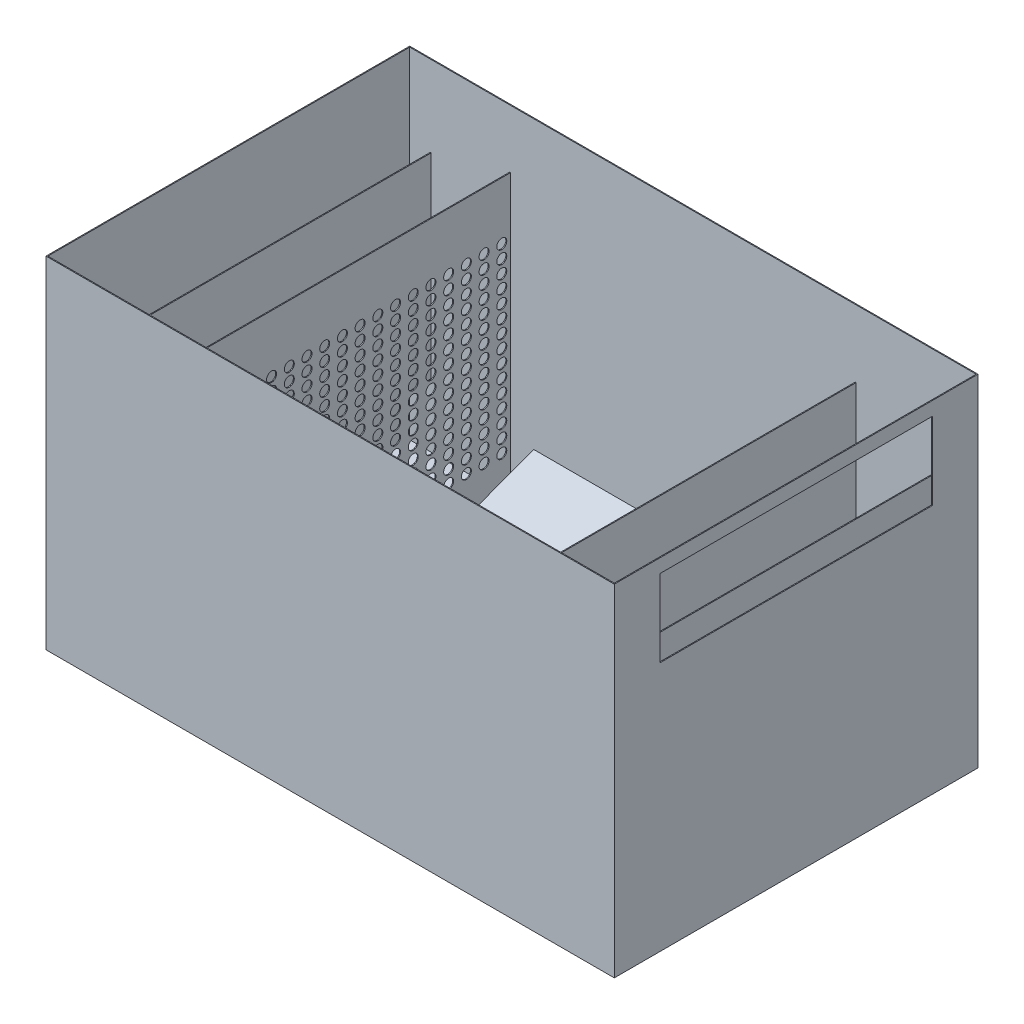
from build123d import *

# Parameters (mm, degrees)
MASTER_FOOTPRINT_W            = 1250
MASTER_FOOTPRINT_H            = 800
BATH_BASE_PLATE_DEPTH         = 750
BATH_SHELL_2MM_T              = -2
SKETCH_1_R                    = 50
INLET_D100_OPENING_DEPTH      = 10
INLET_IMPACT_BAFFLE_START     = 125
SKETCH_2_W                    = 640
SKETCH_2_H                    = 430
INLET_IMPACT_BAFFLE_DEPTH     = 2
DISTRIBUTOR_D22_START         = 250
SKETCH_3_W                    = 740
SKETCH_3_H                    = 648
SKETCH_3_R                    = 11
DISTRIBUTOR_D22_DEPTH         = 2
OUTLET_SUBMERGED_BAFFLE_START = 1030
SKETCH_4_W                    = 700
SKETCH_4_H                    = 330
OUTLET_SUBMERGED_BAFFLE_DEPTH = 2
OVERFLOW_WEIR_Z550_START      = 1190
SKETCH_5_W                    = 790
SKETCH_5_H                    = 548
OVERFLOW_WEIR_Z550_DEPTH      = 2
OUTLET_WEIR_SLOT_W600_START   = 1245
SKETCH_6_W                    = 600
SKETCH_6_H                    = 170
OUTLET_WEIR_SLOT_W600_DEPTH   = 10
SLOPED_SEDIMENT_FLOOR_START   = 275
SLOPED_SEDIMENT_FLOOR_DEPTH   = 725


with BuildPart() as part:
    # MASTER_FOOTPRINT → BATH_BASE_PLATE (new body)
    with BuildSketch(Plane(origin=(0, 0, 0), x_dir=(1, 0, 0), z_dir=(0, 1, 0))):
        with Locations((625, 400)):
            Rectangle(MASTER_FOOTPRINT_W, MASTER_FOOTPRINT_H)
    extrude(amount=BATH_BASE_PLATE_DEPTH)

    # BATH_SHELL_2MM
    bath_shell_2mm_openings = [part.faces().sort_by_distance(p)[0] for p in [
        (625, 750, -400),
    ]]
    offset(amount=BATH_SHELL_2MM_T, openings=bath_shell_2mm_openings, kind=Kind.INTERSECTION)

    # Эскиз1 → INLET_D100_OPENING (cut)
    with BuildSketch(Plane(origin=(0, 0, 0), x_dir=(0, 0, -1), z_dir=(1, 0, 0))):
        with Locations((400, 420)):
            Circle(SKETCH_1_R)
    extrude(amount=INLET_D100_OPENING_DEPTH, mode=Mode.SUBTRACT)

    # Эскиз6 → OUTLET_WEIR_SLOT_W600 (cut)
    with BuildSketch(Plane(origin=(0, 0, 0), x_dir=(0, 0, -1), z_dir=(1, 0, 0)).offset(OUTLET_WEIR_SLOT_W600_START)):
        with Locations((400, 635)):
            Rectangle(SKETCH_6_W, SKETCH_6_H)
    extrude(amount=OUTLET_WEIR_SLOT_W600_DEPTH, mode=Mode.SUBTRACT)

    # Эскиз7 → SLOPED_SEDIMENT_FLOOR (add)
    with BuildSketch(Plane(origin=(0, 0, 0), x_dir=(0, 0, -1), z_dir=(1, 0, 0)).offset(SLOPED_SEDIMENT_FLOOR_START)):
        Polygon((2, -1), (2, 120), (330, -1), align=None)
        Polygon((798, -1), (798, 120), (470, -1), align=None)
    extrude(amount=SLOPED_SEDIMENT_FLOOR_DEPTH)


with BuildPart() as body_2:
    # Эскиз2 → INLET_IMPACT_BAFFLE (new body)
    with BuildSketch(Plane(origin=(0, 0, 0), x_dir=(0, 0, -1), z_dir=(1, 0, 0)).offset(INLET_IMPACT_BAFFLE_START)):
        with Locations((400, 435)):
            Rectangle(SKETCH_2_W, SKETCH_2_H)
    extrude(amount=INLET_IMPACT_BAFFLE_DEPTH)


with BuildPart() as body_3:
    # Эскиз3 → DISTRIBUTOR_D22 (new body)
    with BuildSketch(Plane(origin=(0, 0, 0), x_dir=(0, 0, -1), z_dir=(1, 0, 0)).offset(DISTRIBUTOR_D22_START)):
        with Locations((400, 326)):
            Rectangle(SKETCH_3_W, SKETCH_3_H)
        with Locations((49.473684211, 125)):
            Circle(SKETCH_3_R, mode=Mode.SUBTRACT)
        with Locations((49.473684211, 153.5)):
            Circle(SKETCH_3_R, mode=Mode.SUBTRACT)
        with Locations((49.473684211, 182)):
            Circle(SKETCH_3_R, mode=Mode.SUBTRACT)
        with Locations((49.473684211, 210.5)):
            Circle(SKETCH_3_R, mode=Mode.SUBTRACT)
        with Locations((49.473684211, 239)):
            Circle(SKETCH_3_R, mode=Mode.SUBTRACT)
        with Locations((49.473684211, 267.5)):
            Circle(SKETCH_3_R, mode=Mode.SUBTRACT)
        with Locations((49.473684211, 296)):
            Circle(SKETCH_3_R, mode=Mode.SUBTRACT)
        with Locations((49.473684211, 324.5)):
            Circle(SKETCH_3_R, mode=Mode.SUBTRACT)
        with Locations((49.473684211, 353)):
            Circle(SKETCH_3_R, mode=Mode.SUBTRACT)
        with Locations((49.473684211, 381.5)):
            Circle(SKETCH_3_R, mode=Mode.SUBTRACT)
        with Locations((49.473684211, 410)):
            Circle(SKETCH_3_R, mode=Mode.SUBTRACT)
        with Locations((49.473684211, 438.5)):
            Circle(SKETCH_3_R, mode=Mode.SUBTRACT)
        with Locations((49.473684211, 467)):
            Circle(SKETCH_3_R, mode=Mode.SUBTRACT)
        with Locations((49.473684211, 495.5)):
            Circle(SKETCH_3_R, mode=Mode.SUBTRACT)
        with Locations((49.473684211, 524)):
            Circle(SKETCH_3_R, mode=Mode.SUBTRACT)
        with Locations((88.421052632, 125)):
            Circle(SKETCH_3_R, mode=Mode.SUBTRACT)
        with Locations((88.421052632, 153.5)):
            Circle(SKETCH_3_R, mode=Mode.SUBTRACT)
        with Locations((88.421052632, 182)):
            Circle(SKETCH_3_R, mode=Mode.SUBTRACT)
        with Locations((88.421052632, 210.5)):
            Circle(SKETCH_3_R, mode=Mode.SUBTRACT)
        with Locations((88.421052632, 239)):
            Circle(SKETCH_3_R, mode=Mode.SUBTRACT)
        with Locations((88.421052632, 267.5)):
            Circle(SKETCH_3_R, mode=Mode.SUBTRACT)
        with Locations((88.421052632, 296)):
            Circle(SKETCH_3_R, mode=Mode.SUBTRACT)
        with Locations((88.421052632, 324.5)):
            Circle(SKETCH_3_R, mode=Mode.SUBTRACT)
        with Locations((88.421052632, 353)):
            Circle(SKETCH_3_R, mode=Mode.SUBTRACT)
        with Locations((88.421052632, 381.5)):
            Circle(SKETCH_3_R, mode=Mode.SUBTRACT)
        with Locations((88.421052632, 410)):
            Circle(SKETCH_3_R, mode=Mode.SUBTRACT)
        with Locations((88.421052632, 438.5)):
            Circle(SKETCH_3_R, mode=Mode.SUBTRACT)
        with Locations((88.421052632, 467)):
            Circle(SKETCH_3_R, mode=Mode.SUBTRACT)
        with Locations((88.421052632, 495.5)):
            Circle(SKETCH_3_R, mode=Mode.SUBTRACT)
        with Locations((88.421052632, 524)):
            Circle(SKETCH_3_R, mode=Mode.SUBTRACT)
        with Locations((127.368421053, 125)):
            Circle(SKETCH_3_R, mode=Mode.SUBTRACT)
        with Locations((127.368421053, 153.5)):
            Circle(SKETCH_3_R, mode=Mode.SUBTRACT)
        with Locations((127.368421053, 182)):
            Circle(SKETCH_3_R, mode=Mode.SUBTRACT)
        with Locations((127.368421053, 210.5)):
            Circle(SKETCH_3_R, mode=Mode.SUBTRACT)
        with Locations((127.368421053, 239)):
            Circle(SKETCH_3_R, mode=Mode.SUBTRACT)
        with Locations((127.368421053, 267.5)):
            Circle(SKETCH_3_R, mode=Mode.SUBTRACT)
        with Locations((127.368421053, 296)):
            Circle(SKETCH_3_R, mode=Mode.SUBTRACT)
        with Locations((127.368421053, 324.5)):
            Circle(SKETCH_3_R, mode=Mode.SUBTRACT)
        with Locations((127.368421053, 353)):
            Circle(SKETCH_3_R, mode=Mode.SUBTRACT)
        with Locations((127.368421053, 381.5)):
            Circle(SKETCH_3_R, mode=Mode.SUBTRACT)
        with Locations((127.368421053, 410)):
            Circle(SKETCH_3_R, mode=Mode.SUBTRACT)
        with Locations((127.368421053, 438.5)):
            Circle(SKETCH_3_R, mode=Mode.SUBTRACT)
        with Locations((127.368421053, 467)):
            Circle(SKETCH_3_R, mode=Mode.SUBTRACT)
        with Locations((127.368421053, 495.5)):
            Circle(SKETCH_3_R, mode=Mode.SUBTRACT)
        with Locations((127.368421053, 524)):
            Circle(SKETCH_3_R, mode=Mode.SUBTRACT)
        with Locations((166.315789474, 125)):
            Circle(SKETCH_3_R, mode=Mode.SUBTRACT)
        with Locations((166.315789474, 153.5)):
            Circle(SKETCH_3_R, mode=Mode.SUBTRACT)
        with Locations((166.315789474, 182)):
            Circle(SKETCH_3_R, mode=Mode.SUBTRACT)
        with Locations((166.315789474, 210.5)):
            Circle(SKETCH_3_R, mode=Mode.SUBTRACT)
        with Locations((166.315789474, 239)):
            Circle(SKETCH_3_R, mode=Mode.SUBTRACT)
        with Locations((166.315789474, 267.5)):
            Circle(SKETCH_3_R, mode=Mode.SUBTRACT)
        with Locations((166.315789474, 296)):
            Circle(SKETCH_3_R, mode=Mode.SUBTRACT)
        with Locations((166.315789474, 324.5)):
            Circle(SKETCH_3_R, mode=Mode.SUBTRACT)
        with Locations((166.315789474, 353)):
            Circle(SKETCH_3_R, mode=Mode.SUBTRACT)
        with Locations((166.315789474, 381.5)):
            Circle(SKETCH_3_R, mode=Mode.SUBTRACT)
        with Locations((166.315789474, 410)):
            Circle(SKETCH_3_R, mode=Mode.SUBTRACT)
        with Locations((166.315789474, 438.5)):
            Circle(SKETCH_3_R, mode=Mode.SUBTRACT)
        with Locations((166.315789474, 467)):
            Circle(SKETCH_3_R, mode=Mode.SUBTRACT)
        with Locations((166.315789474, 495.5)):
            Circle(SKETCH_3_R, mode=Mode.SUBTRACT)
        with Locations((166.315789474, 524)):
            Circle(SKETCH_3_R, mode=Mode.SUBTRACT)
        with Locations((205.263157895, 125)):
            Circle(SKETCH_3_R, mode=Mode.SUBTRACT)
        with Locations((205.263157895, 153.5)):
            Circle(SKETCH_3_R, mode=Mode.SUBTRACT)
        with Locations((205.263157895, 182)):
            Circle(SKETCH_3_R, mode=Mode.SUBTRACT)
        with Locations((205.263157895, 210.5)):
            Circle(SKETCH_3_R, mode=Mode.SUBTRACT)
        with Locations((205.263157895, 239)):
            Circle(SKETCH_3_R, mode=Mode.SUBTRACT)
        with Locations((205.263157895, 267.5)):
            Circle(SKETCH_3_R, mode=Mode.SUBTRACT)
        with Locations((205.263157895, 296)):
            Circle(SKETCH_3_R, mode=Mode.SUBTRACT)
        with Locations((205.263157895, 324.5)):
            Circle(SKETCH_3_R, mode=Mode.SUBTRACT)
        with Locations((205.263157895, 353)):
            Circle(SKETCH_3_R, mode=Mode.SUBTRACT)
        with Locations((205.263157895, 381.5)):
            Circle(SKETCH_3_R, mode=Mode.SUBTRACT)
        with Locations((205.263157895, 410)):
            Circle(SKETCH_3_R, mode=Mode.SUBTRACT)
        with Locations((205.263157895, 438.5)):
            Circle(SKETCH_3_R, mode=Mode.SUBTRACT)
        with Locations((205.263157895, 467)):
            Circle(SKETCH_3_R, mode=Mode.SUBTRACT)
        with Locations((205.263157895, 495.5)):
            Circle(SKETCH_3_R, mode=Mode.SUBTRACT)
        with Locations((205.263157895, 524)):
            Circle(SKETCH_3_R, mode=Mode.SUBTRACT)
        with Locations((244.210526316, 125)):
            Circle(SKETCH_3_R, mode=Mode.SUBTRACT)
        with Locations((244.210526316, 153.5)):
            Circle(SKETCH_3_R, mode=Mode.SUBTRACT)
        with Locations((244.210526316, 182)):
            Circle(SKETCH_3_R, mode=Mode.SUBTRACT)
        with Locations((244.210526316, 210.5)):
            Circle(SKETCH_3_R, mode=Mode.SUBTRACT)
        with Locations((244.210526316, 239)):
            Circle(SKETCH_3_R, mode=Mode.SUBTRACT)
        with Locations((244.210526316, 267.5)):
            Circle(SKETCH_3_R, mode=Mode.SUBTRACT)
        with Locations((244.210526316, 296)):
            Circle(SKETCH_3_R, mode=Mode.SUBTRACT)
        with Locations((244.210526316, 324.5)):
            Circle(SKETCH_3_R, mode=Mode.SUBTRACT)
        with Locations((244.210526316, 353)):
            Circle(SKETCH_3_R, mode=Mode.SUBTRACT)
        with Locations((244.210526316, 381.5)):
            Circle(SKETCH_3_R, mode=Mode.SUBTRACT)
        with Locations((244.210526316, 410)):
            Circle(SKETCH_3_R, mode=Mode.SUBTRACT)
        with Locations((244.210526316, 438.5)):
            Circle(SKETCH_3_R, mode=Mode.SUBTRACT)
        with Locations((244.210526316, 467)):
            Circle(SKETCH_3_R, mode=Mode.SUBTRACT)
        with Locations((244.210526316, 495.5)):
            Circle(SKETCH_3_R, mode=Mode.SUBTRACT)
        with Locations((244.210526316, 524)):
            Circle(SKETCH_3_R, mode=Mode.SUBTRACT)
        with Locations((283.157894737, 125)):
            Circle(SKETCH_3_R, mode=Mode.SUBTRACT)
        with Locations((283.157894737, 153.5)):
            Circle(SKETCH_3_R, mode=Mode.SUBTRACT)
        with Locations((283.157894737, 182)):
            Circle(SKETCH_3_R, mode=Mode.SUBTRACT)
        with Locations((283.157894737, 210.5)):
            Circle(SKETCH_3_R, mode=Mode.SUBTRACT)
        with Locations((283.157894737, 239)):
            Circle(SKETCH_3_R, mode=Mode.SUBTRACT)
        with Locations((283.157894737, 267.5)):
            Circle(SKETCH_3_R, mode=Mode.SUBTRACT)
        with Locations((283.157894737, 296)):
            Circle(SKETCH_3_R, mode=Mode.SUBTRACT)
        with Locations((283.157894737, 324.5)):
            Circle(SKETCH_3_R, mode=Mode.SUBTRACT)
        with Locations((283.157894737, 353)):
            Circle(SKETCH_3_R, mode=Mode.SUBTRACT)
        with Locations((283.157894737, 381.5)):
            Circle(SKETCH_3_R, mode=Mode.SUBTRACT)
        with Locations((283.157894737, 410)):
            Circle(SKETCH_3_R, mode=Mode.SUBTRACT)
        with Locations((283.157894737, 438.5)):
            Circle(SKETCH_3_R, mode=Mode.SUBTRACT)
        with Locations((283.157894737, 467)):
            Circle(SKETCH_3_R, mode=Mode.SUBTRACT)
        with Locations((283.157894737, 495.5)):
            Circle(SKETCH_3_R, mode=Mode.SUBTRACT)
        with Locations((283.157894737, 524)):
            Circle(SKETCH_3_R, mode=Mode.SUBTRACT)
        with Locations((322.105263158, 125)):
            Circle(SKETCH_3_R, mode=Mode.SUBTRACT)
        with Locations((322.105263158, 153.5)):
            Circle(SKETCH_3_R, mode=Mode.SUBTRACT)
        with Locations((322.105263158, 182)):
            Circle(SKETCH_3_R, mode=Mode.SUBTRACT)
        with Locations((322.105263158, 210.5)):
            Circle(SKETCH_3_R, mode=Mode.SUBTRACT)
        with Locations((322.105263158, 239)):
            Circle(SKETCH_3_R, mode=Mode.SUBTRACT)
        with Locations((322.105263158, 267.5)):
            Circle(SKETCH_3_R, mode=Mode.SUBTRACT)
        with Locations((322.105263158, 296)):
            Circle(SKETCH_3_R, mode=Mode.SUBTRACT)
        with Locations((322.105263158, 324.5)):
            Circle(SKETCH_3_R, mode=Mode.SUBTRACT)
        with Locations((322.105263158, 353)):
            Circle(SKETCH_3_R, mode=Mode.SUBTRACT)
        with Locations((322.105263158, 381.5)):
            Circle(SKETCH_3_R, mode=Mode.SUBTRACT)
        with Locations((322.105263158, 410)):
            Circle(SKETCH_3_R, mode=Mode.SUBTRACT)
        with Locations((322.105263158, 438.5)):
            Circle(SKETCH_3_R, mode=Mode.SUBTRACT)
        with Locations((322.105263158, 467)):
            Circle(SKETCH_3_R, mode=Mode.SUBTRACT)
        with Locations((322.105263158, 495.5)):
            Circle(SKETCH_3_R, mode=Mode.SUBTRACT)
        with Locations((322.105263158, 524)):
            Circle(SKETCH_3_R, mode=Mode.SUBTRACT)
        with Locations((361.052631579, 125)):
            Circle(SKETCH_3_R, mode=Mode.SUBTRACT)
        with Locations((361.052631579, 153.5)):
            Circle(SKETCH_3_R, mode=Mode.SUBTRACT)
        with Locations((361.052631579, 182)):
            Circle(SKETCH_3_R, mode=Mode.SUBTRACT)
        with Locations((361.052631579, 210.5)):
            Circle(SKETCH_3_R, mode=Mode.SUBTRACT)
        with Locations((361.052631579, 239)):
            Circle(SKETCH_3_R, mode=Mode.SUBTRACT)
        with Locations((361.052631579, 267.5)):
            Circle(SKETCH_3_R, mode=Mode.SUBTRACT)
        with Locations((361.052631579, 296)):
            Circle(SKETCH_3_R, mode=Mode.SUBTRACT)
        with Locations((361.052631579, 324.5)):
            Circle(SKETCH_3_R, mode=Mode.SUBTRACT)
        with Locations((361.052631579, 353)):
            Circle(SKETCH_3_R, mode=Mode.SUBTRACT)
        with Locations((361.052631579, 381.5)):
            Circle(SKETCH_3_R, mode=Mode.SUBTRACT)
        with Locations((361.052631579, 410)):
            Circle(SKETCH_3_R, mode=Mode.SUBTRACT)
        with Locations((361.052631579, 438.5)):
            Circle(SKETCH_3_R, mode=Mode.SUBTRACT)
        with Locations((361.052631579, 467)):
            Circle(SKETCH_3_R, mode=Mode.SUBTRACT)
        with Locations((361.052631579, 495.5)):
            Circle(SKETCH_3_R, mode=Mode.SUBTRACT)
        with Locations((361.052631579, 524)):
            Circle(SKETCH_3_R, mode=Mode.SUBTRACT)
        with Locations((400, 125)):
            Circle(SKETCH_3_R, mode=Mode.SUBTRACT)
        with Locations((400, 153.5)):
            Circle(SKETCH_3_R, mode=Mode.SUBTRACT)
        with Locations((400, 182)):
            Circle(SKETCH_3_R, mode=Mode.SUBTRACT)
        with Locations((400, 210.5)):
            Circle(SKETCH_3_R, mode=Mode.SUBTRACT)
        with Locations((400, 239)):
            Circle(SKETCH_3_R, mode=Mode.SUBTRACT)
        with Locations((400, 267.5)):
            Circle(SKETCH_3_R, mode=Mode.SUBTRACT)
        with Locations((400, 296)):
            Circle(SKETCH_3_R, mode=Mode.SUBTRACT)
        with Locations((400, 324.5)):
            Circle(SKETCH_3_R, mode=Mode.SUBTRACT)
        with Locations((400, 353)):
            Circle(SKETCH_3_R, mode=Mode.SUBTRACT)
        with Locations((400, 381.5)):
            Circle(SKETCH_3_R, mode=Mode.SUBTRACT)
        with Locations((400, 410)):
            Circle(SKETCH_3_R, mode=Mode.SUBTRACT)
        with Locations((400, 438.5)):
            Circle(SKETCH_3_R, mode=Mode.SUBTRACT)
        with Locations((400, 467)):
            Circle(SKETCH_3_R, mode=Mode.SUBTRACT)
        with Locations((400, 495.5)):
            Circle(SKETCH_3_R, mode=Mode.SUBTRACT)
        with Locations((400, 524)):
            Circle(SKETCH_3_R, mode=Mode.SUBTRACT)
        with Locations((438.947368421, 125)):
            Circle(SKETCH_3_R, mode=Mode.SUBTRACT)
        with Locations((438.947368421, 153.5)):
            Circle(SKETCH_3_R, mode=Mode.SUBTRACT)
        with Locations((438.947368421, 182)):
            Circle(SKETCH_3_R, mode=Mode.SUBTRACT)
        with Locations((438.947368421, 210.5)):
            Circle(SKETCH_3_R, mode=Mode.SUBTRACT)
        with Locations((438.947368421, 239)):
            Circle(SKETCH_3_R, mode=Mode.SUBTRACT)
        with Locations((438.947368421, 267.5)):
            Circle(SKETCH_3_R, mode=Mode.SUBTRACT)
        with Locations((438.947368421, 296)):
            Circle(SKETCH_3_R, mode=Mode.SUBTRACT)
        with Locations((438.947368421, 324.5)):
            Circle(SKETCH_3_R, mode=Mode.SUBTRACT)
        with Locations((438.947368421, 353)):
            Circle(SKETCH_3_R, mode=Mode.SUBTRACT)
        with Locations((438.947368421, 381.5)):
            Circle(SKETCH_3_R, mode=Mode.SUBTRACT)
        with Locations((438.947368421, 410)):
            Circle(SKETCH_3_R, mode=Mode.SUBTRACT)
        with Locations((438.947368421, 438.5)):
            Circle(SKETCH_3_R, mode=Mode.SUBTRACT)
        with Locations((438.947368421, 467)):
            Circle(SKETCH_3_R, mode=Mode.SUBTRACT)
        with Locations((438.947368421, 495.5)):
            Circle(SKETCH_3_R, mode=Mode.SUBTRACT)
        with Locations((438.947368421, 524)):
            Circle(SKETCH_3_R, mode=Mode.SUBTRACT)
        with Locations((477.894736842, 125)):
            Circle(SKETCH_3_R, mode=Mode.SUBTRACT)
        with Locations((477.894736842, 153.5)):
            Circle(SKETCH_3_R, mode=Mode.SUBTRACT)
        with Locations((477.894736842, 182)):
            Circle(SKETCH_3_R, mode=Mode.SUBTRACT)
        with Locations((477.894736842, 210.5)):
            Circle(SKETCH_3_R, mode=Mode.SUBTRACT)
        with Locations((477.894736842, 239)):
            Circle(SKETCH_3_R, mode=Mode.SUBTRACT)
        with Locations((477.894736842, 267.5)):
            Circle(SKETCH_3_R, mode=Mode.SUBTRACT)
        with Locations((477.894736842, 296)):
            Circle(SKETCH_3_R, mode=Mode.SUBTRACT)
        with Locations((477.894736842, 324.5)):
            Circle(SKETCH_3_R, mode=Mode.SUBTRACT)
        with Locations((477.894736842, 353)):
            Circle(SKETCH_3_R, mode=Mode.SUBTRACT)
        with Locations((477.894736842, 381.5)):
            Circle(SKETCH_3_R, mode=Mode.SUBTRACT)
        with Locations((477.894736842, 410)):
            Circle(SKETCH_3_R, mode=Mode.SUBTRACT)
        with Locations((477.894736842, 438.5)):
            Circle(SKETCH_3_R, mode=Mode.SUBTRACT)
        with Locations((477.894736842, 467)):
            Circle(SKETCH_3_R, mode=Mode.SUBTRACT)
        with Locations((477.894736842, 495.5)):
            Circle(SKETCH_3_R, mode=Mode.SUBTRACT)
        with Locations((477.894736842, 524)):
            Circle(SKETCH_3_R, mode=Mode.SUBTRACT)
        with Locations((516.842105263, 125)):
            Circle(SKETCH_3_R, mode=Mode.SUBTRACT)
        with Locations((516.842105263, 153.5)):
            Circle(SKETCH_3_R, mode=Mode.SUBTRACT)
        with Locations((516.842105263, 182)):
            Circle(SKETCH_3_R, mode=Mode.SUBTRACT)
        with Locations((516.842105263, 210.5)):
            Circle(SKETCH_3_R, mode=Mode.SUBTRACT)
        with Locations((516.842105263, 239)):
            Circle(SKETCH_3_R, mode=Mode.SUBTRACT)
        with Locations((516.842105263, 267.5)):
            Circle(SKETCH_3_R, mode=Mode.SUBTRACT)
        with Locations((516.842105263, 296)):
            Circle(SKETCH_3_R, mode=Mode.SUBTRACT)
        with Locations((516.842105263, 324.5)):
            Circle(SKETCH_3_R, mode=Mode.SUBTRACT)
        with Locations((516.842105263, 353)):
            Circle(SKETCH_3_R, mode=Mode.SUBTRACT)
        with Locations((516.842105263, 381.5)):
            Circle(SKETCH_3_R, mode=Mode.SUBTRACT)
        with Locations((516.842105263, 410)):
            Circle(SKETCH_3_R, mode=Mode.SUBTRACT)
        with Locations((516.842105263, 438.5)):
            Circle(SKETCH_3_R, mode=Mode.SUBTRACT)
        with Locations((516.842105263, 467)):
            Circle(SKETCH_3_R, mode=Mode.SUBTRACT)
        with Locations((516.842105263, 495.5)):
            Circle(SKETCH_3_R, mode=Mode.SUBTRACT)
        with Locations((516.842105263, 524)):
            Circle(SKETCH_3_R, mode=Mode.SUBTRACT)
        with Locations((555.789473684, 125)):
            Circle(SKETCH_3_R, mode=Mode.SUBTRACT)
        with Locations((555.789473684, 153.5)):
            Circle(SKETCH_3_R, mode=Mode.SUBTRACT)
        with Locations((555.789473684, 182)):
            Circle(SKETCH_3_R, mode=Mode.SUBTRACT)
        with Locations((555.789473684, 210.5)):
            Circle(SKETCH_3_R, mode=Mode.SUBTRACT)
        with Locations((555.789473684, 239)):
            Circle(SKETCH_3_R, mode=Mode.SUBTRACT)
        with Locations((555.789473684, 267.5)):
            Circle(SKETCH_3_R, mode=Mode.SUBTRACT)
        with Locations((555.789473684, 296)):
            Circle(SKETCH_3_R, mode=Mode.SUBTRACT)
        with Locations((555.789473684, 324.5)):
            Circle(SKETCH_3_R, mode=Mode.SUBTRACT)
        with Locations((555.789473684, 353)):
            Circle(SKETCH_3_R, mode=Mode.SUBTRACT)
        with Locations((555.789473684, 381.5)):
            Circle(SKETCH_3_R, mode=Mode.SUBTRACT)
        with Locations((555.789473684, 410)):
            Circle(SKETCH_3_R, mode=Mode.SUBTRACT)
        with Locations((555.789473684, 438.5)):
            Circle(SKETCH_3_R, mode=Mode.SUBTRACT)
        with Locations((555.789473684, 467)):
            Circle(SKETCH_3_R, mode=Mode.SUBTRACT)
        with Locations((555.789473684, 495.5)):
            Circle(SKETCH_3_R, mode=Mode.SUBTRACT)
        with Locations((555.789473684, 524)):
            Circle(SKETCH_3_R, mode=Mode.SUBTRACT)
        with Locations((594.736842105, 125)):
            Circle(SKETCH_3_R, mode=Mode.SUBTRACT)
        with Locations((594.736842105, 153.5)):
            Circle(SKETCH_3_R, mode=Mode.SUBTRACT)
        with Locations((594.736842105, 182)):
            Circle(SKETCH_3_R, mode=Mode.SUBTRACT)
        with Locations((594.736842105, 210.5)):
            Circle(SKETCH_3_R, mode=Mode.SUBTRACT)
        with Locations((594.736842105, 239)):
            Circle(SKETCH_3_R, mode=Mode.SUBTRACT)
        with Locations((594.736842105, 267.5)):
            Circle(SKETCH_3_R, mode=Mode.SUBTRACT)
        with Locations((594.736842105, 296)):
            Circle(SKETCH_3_R, mode=Mode.SUBTRACT)
        with Locations((594.736842105, 324.5)):
            Circle(SKETCH_3_R, mode=Mode.SUBTRACT)
        with Locations((594.736842105, 353)):
            Circle(SKETCH_3_R, mode=Mode.SUBTRACT)
        with Locations((594.736842105, 381.5)):
            Circle(SKETCH_3_R, mode=Mode.SUBTRACT)
        with Locations((594.736842105, 410)):
            Circle(SKETCH_3_R, mode=Mode.SUBTRACT)
        with Locations((594.736842105, 438.5)):
            Circle(SKETCH_3_R, mode=Mode.SUBTRACT)
        with Locations((594.736842105, 467)):
            Circle(SKETCH_3_R, mode=Mode.SUBTRACT)
        with Locations((594.736842105, 495.5)):
            Circle(SKETCH_3_R, mode=Mode.SUBTRACT)
        with Locations((594.736842105, 524)):
            Circle(SKETCH_3_R, mode=Mode.SUBTRACT)
        with Locations((633.684210526, 125)):
            Circle(SKETCH_3_R, mode=Mode.SUBTRACT)
        with Locations((633.684210526, 153.5)):
            Circle(SKETCH_3_R, mode=Mode.SUBTRACT)
        with Locations((633.684210526, 182)):
            Circle(SKETCH_3_R, mode=Mode.SUBTRACT)
        with Locations((633.684210526, 210.5)):
            Circle(SKETCH_3_R, mode=Mode.SUBTRACT)
        with Locations((633.684210526, 239)):
            Circle(SKETCH_3_R, mode=Mode.SUBTRACT)
        with Locations((633.684210526, 267.5)):
            Circle(SKETCH_3_R, mode=Mode.SUBTRACT)
        with Locations((633.684210526, 296)):
            Circle(SKETCH_3_R, mode=Mode.SUBTRACT)
        with Locations((633.684210526, 324.5)):
            Circle(SKETCH_3_R, mode=Mode.SUBTRACT)
        with Locations((633.684210526, 353)):
            Circle(SKETCH_3_R, mode=Mode.SUBTRACT)
        with Locations((633.684210526, 381.5)):
            Circle(SKETCH_3_R, mode=Mode.SUBTRACT)
        with Locations((633.684210526, 410)):
            Circle(SKETCH_3_R, mode=Mode.SUBTRACT)
        with Locations((633.684210526, 438.5)):
            Circle(SKETCH_3_R, mode=Mode.SUBTRACT)
        with Locations((633.684210526, 467)):
            Circle(SKETCH_3_R, mode=Mode.SUBTRACT)
        with Locations((633.684210526, 495.5)):
            Circle(SKETCH_3_R, mode=Mode.SUBTRACT)
        with Locations((633.684210526, 524)):
            Circle(SKETCH_3_R, mode=Mode.SUBTRACT)
        with Locations((672.631578947, 125)):
            Circle(SKETCH_3_R, mode=Mode.SUBTRACT)
        with Locations((672.631578947, 153.5)):
            Circle(SKETCH_3_R, mode=Mode.SUBTRACT)
        with Locations((672.631578947, 182)):
            Circle(SKETCH_3_R, mode=Mode.SUBTRACT)
        with Locations((672.631578947, 210.5)):
            Circle(SKETCH_3_R, mode=Mode.SUBTRACT)
        with Locations((672.631578947, 239)):
            Circle(SKETCH_3_R, mode=Mode.SUBTRACT)
        with Locations((672.631578947, 267.5)):
            Circle(SKETCH_3_R, mode=Mode.SUBTRACT)
        with Locations((672.631578947, 296)):
            Circle(SKETCH_3_R, mode=Mode.SUBTRACT)
        with Locations((672.631578947, 324.5)):
            Circle(SKETCH_3_R, mode=Mode.SUBTRACT)
        with Locations((672.631578947, 353)):
            Circle(SKETCH_3_R, mode=Mode.SUBTRACT)
        with Locations((672.631578947, 381.5)):
            Circle(SKETCH_3_R, mode=Mode.SUBTRACT)
        with Locations((672.631578947, 410)):
            Circle(SKETCH_3_R, mode=Mode.SUBTRACT)
        with Locations((672.631578947, 438.5)):
            Circle(SKETCH_3_R, mode=Mode.SUBTRACT)
        with Locations((672.631578947, 467)):
            Circle(SKETCH_3_R, mode=Mode.SUBTRACT)
        with Locations((672.631578947, 495.5)):
            Circle(SKETCH_3_R, mode=Mode.SUBTRACT)
        with Locations((672.631578947, 524)):
            Circle(SKETCH_3_R, mode=Mode.SUBTRACT)
        with Locations((711.578947368, 125)):
            Circle(SKETCH_3_R, mode=Mode.SUBTRACT)
        with Locations((711.578947368, 153.5)):
            Circle(SKETCH_3_R, mode=Mode.SUBTRACT)
        with Locations((711.578947368, 182)):
            Circle(SKETCH_3_R, mode=Mode.SUBTRACT)
        with Locations((711.578947368, 210.5)):
            Circle(SKETCH_3_R, mode=Mode.SUBTRACT)
        with Locations((711.578947368, 239)):
            Circle(SKETCH_3_R, mode=Mode.SUBTRACT)
        with Locations((711.578947368, 267.5)):
            Circle(SKETCH_3_R, mode=Mode.SUBTRACT)
        with Locations((711.578947368, 296)):
            Circle(SKETCH_3_R, mode=Mode.SUBTRACT)
        with Locations((711.578947368, 324.5)):
            Circle(SKETCH_3_R, mode=Mode.SUBTRACT)
        with Locations((711.578947368, 353)):
            Circle(SKETCH_3_R, mode=Mode.SUBTRACT)
        with Locations((711.578947368, 381.5)):
            Circle(SKETCH_3_R, mode=Mode.SUBTRACT)
        with Locations((711.578947368, 410)):
            Circle(SKETCH_3_R, mode=Mode.SUBTRACT)
        with Locations((711.578947368, 438.5)):
            Circle(SKETCH_3_R, mode=Mode.SUBTRACT)
        with Locations((711.578947368, 467)):
            Circle(SKETCH_3_R, mode=Mode.SUBTRACT)
        with Locations((711.578947368, 495.5)):
            Circle(SKETCH_3_R, mode=Mode.SUBTRACT)
        with Locations((711.578947368, 524)):
            Circle(SKETCH_3_R, mode=Mode.SUBTRACT)
        with Locations((750.526315789, 125)):
            Circle(SKETCH_3_R, mode=Mode.SUBTRACT)
        with Locations((750.526315789, 153.5)):
            Circle(SKETCH_3_R, mode=Mode.SUBTRACT)
        with Locations((750.526315789, 182)):
            Circle(SKETCH_3_R, mode=Mode.SUBTRACT)
        with Locations((750.526315789, 210.5)):
            Circle(SKETCH_3_R, mode=Mode.SUBTRACT)
        with Locations((750.526315789, 239)):
            Circle(SKETCH_3_R, mode=Mode.SUBTRACT)
        with Locations((750.526315789, 267.5)):
            Circle(SKETCH_3_R, mode=Mode.SUBTRACT)
        with Locations((750.526315789, 296)):
            Circle(SKETCH_3_R, mode=Mode.SUBTRACT)
        with Locations((750.526315789, 324.5)):
            Circle(SKETCH_3_R, mode=Mode.SUBTRACT)
        with Locations((750.526315789, 353)):
            Circle(SKETCH_3_R, mode=Mode.SUBTRACT)
        with Locations((750.526315789, 381.5)):
            Circle(SKETCH_3_R, mode=Mode.SUBTRACT)
        with Locations((750.526315789, 410)):
            Circle(SKETCH_3_R, mode=Mode.SUBTRACT)
        with Locations((750.526315789, 438.5)):
            Circle(SKETCH_3_R, mode=Mode.SUBTRACT)
        with Locations((750.526315789, 467)):
            Circle(SKETCH_3_R, mode=Mode.SUBTRACT)
        with Locations((750.526315789, 495.5)):
            Circle(SKETCH_3_R, mode=Mode.SUBTRACT)
        with Locations((750.526315789, 524)):
            Circle(SKETCH_3_R, mode=Mode.SUBTRACT)
    extrude(amount=DISTRIBUTOR_D22_DEPTH)


with BuildPart() as body_4:
    # Эскиз4 → OUTLET_SUBMERGED_BAFFLE (new body)
    with BuildSketch(Plane(origin=(0, 0, 0), x_dir=(0, 0, -1), z_dir=(1, 0, 0)).offset(OUTLET_SUBMERGED_BAFFLE_START)):
        with Locations((400, 485)):
            Rectangle(SKETCH_4_W, SKETCH_4_H)
    extrude(amount=OUTLET_SUBMERGED_BAFFLE_DEPTH)


with BuildPart() as body_5:
    # Эскиз5 → OVERFLOW_WEIR_Z550 (new body)
    with BuildSketch(Plane(origin=(0, 0, 0), x_dir=(0, 0, -1), z_dir=(1, 0, 0)).offset(OVERFLOW_WEIR_Z550_START)):
        with Locations((400, 276)):
            Rectangle(SKETCH_5_W, SKETCH_5_H)
    extrude(amount=OVERFLOW_WEIR_Z550_DEPTH)


solid = Compound([part.part, body_2.part, body_3.part, body_4.part, body_5.part])
